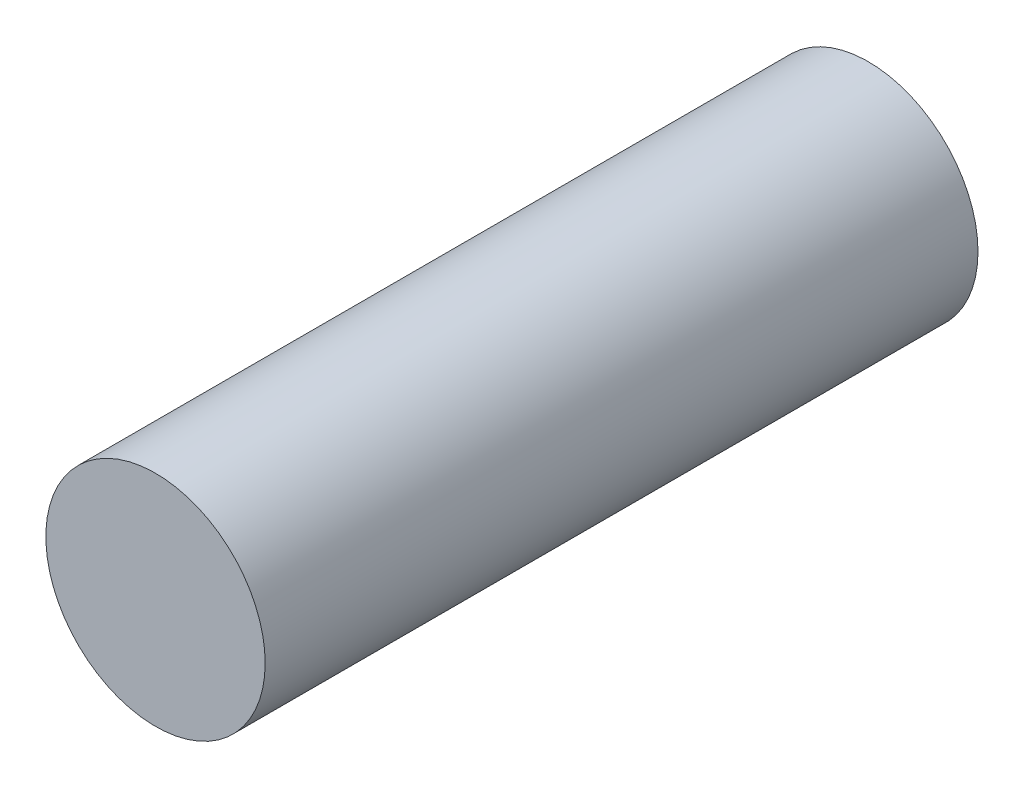
from build123d import *

# Parameters (mm, degrees)
SKETCH1_W = 6
SKETCH1_H = 39


with BuildPart() as part:
    # Sketch1 → Revolve1 (revolve)
    with BuildSketch(Plane(origin=(0, -43, 0), x_dir=(1, 0, 0), z_dir=(0, 1, 0))):
        with Locations((24, -15)):
            Rectangle(SKETCH1_W, SKETCH1_H)
    revolve(axis=Axis((21, -43, -4.5), (0, 0, 1)))


solid = part.part
